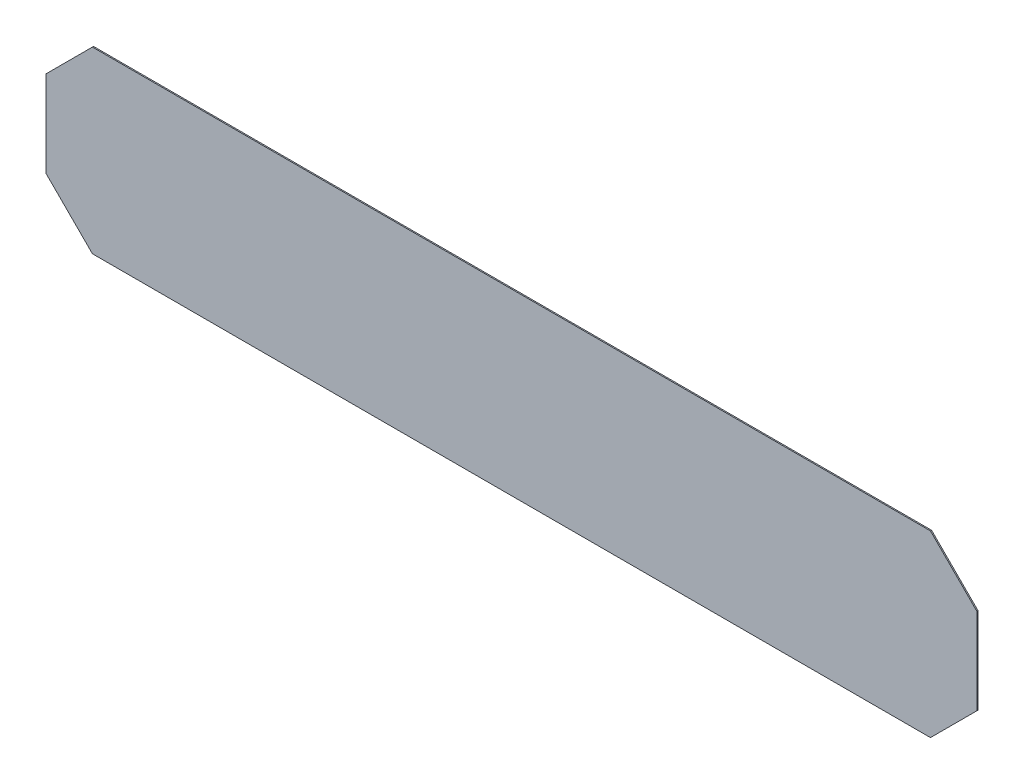
from build123d import *

# Parameters (mm, degrees)
SKETCH1_W           = 82.55
SKETCH1_H           = 15.875
BOSS_EXTRUDE1_DEPTH = 0.1016
CHAMFER1_SIZE       = 4.1148


with BuildPart() as part:
    # Sketch1 → Boss-Extrude1 (new body)
    with BuildSketch(Plane.XY):
        Rectangle(SKETCH1_W, SKETCH1_H)
    extrude(amount=BOSS_EXTRUDE1_DEPTH)

    # Chamfer1
    chamfer1_edges = [part.edges().sort_by_distance(p)[0] for p in [
        (41.275, -7.9375, 0.0508),
        (-41.275, -7.9375, 0.0508),
        (-41.275, 7.9375, 0.0508),
        (41.275, 7.9375, 0.0508),
    ]]
    chamfer(chamfer1_edges, length=CHAMFER1_SIZE)


solid = part.part
